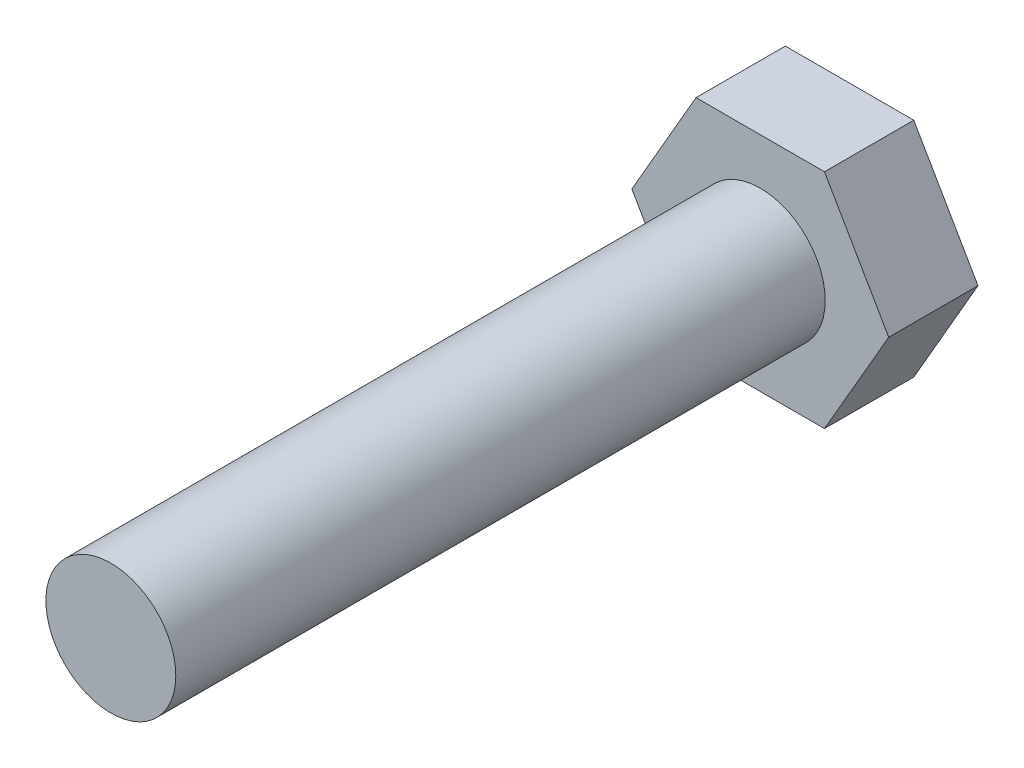
from build123d import *

# Parameters (mm, degrees)
EXTRUDE_1_DEPTH = 2.75
SKETCH_2_R      = 2
EXTRUDE_2_DEPTH = 20


with BuildPart() as part:
    # ｽｹｯﾁ1 → ﾎﾞｽ - 押し出し1 (new body)
    with BuildSketch(Plane.XY):
        Polygon((3.954849344, 0), (1.977424672, 3.425), (-1.977424672, 3.425), (-3.954849344, 0), (-1.977424672, -3.425), (1.977424672, -3.425), align=None)
    extrude(amount=EXTRUDE_1_DEPTH)

    # ｽｹｯﾁ2 → ﾎﾞｽ - 押し出し2 (add)
    with BuildSketch(Plane.XY.offset(2.75)):
        Circle(SKETCH_2_R)
    extrude(amount=EXTRUDE_2_DEPTH)


solid = part.part
